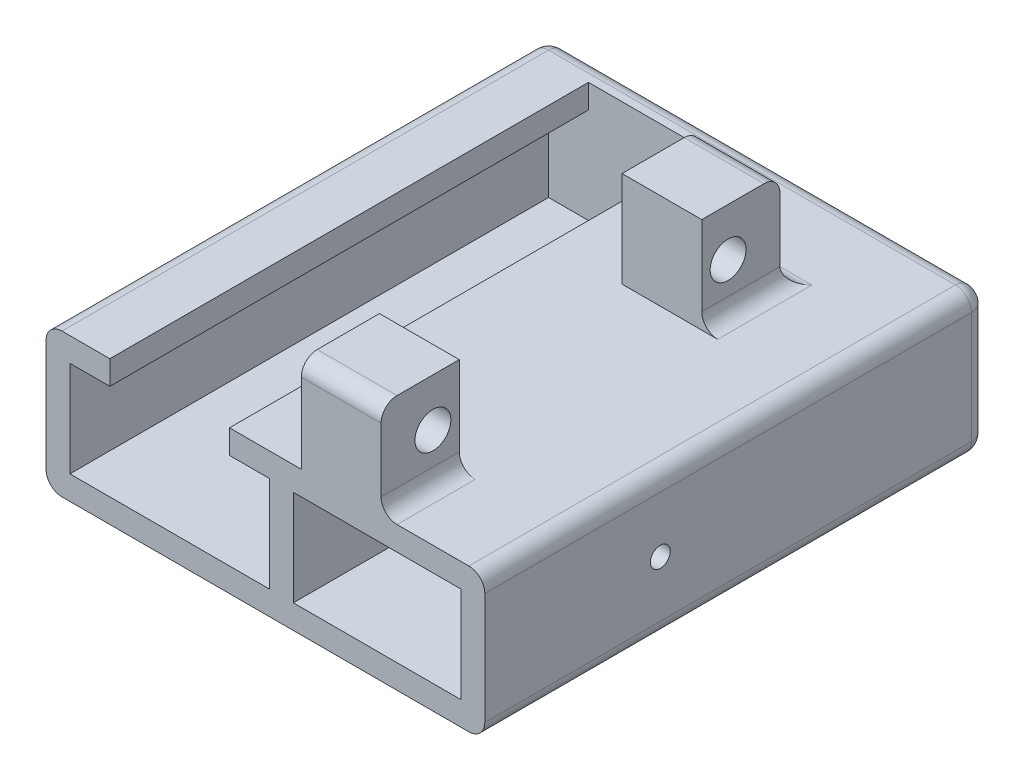
from build123d import *

# Parameters (mm, degrees)
SKETCH1_W           = 21
SKETCH1_H           = 12
BOSS_EXTRUDE1_DEPTH = 60
SKETCH2_R           = 2.25
BOSS_EXTRUDE2_DEPTH = 10
SKETCH3_W           = 55
SKETCH3_H           = 18
BOSS_EXTRUDE3_DEPTH = 3
FILLET1_R           = 2
SKETCH4_R           = 1.25
CUT_EXTRUDE1_DEPTH  = 30


with BuildPart() as part:
    # Sketch1 → Boss-Extrude1 (new body)
    with BuildSketch(Plane.XY):
        Polygon((17.509291985, 21.588576814), (-9.490708015, 21.588576814), (-14.490708015, 21.588576814), (-14.490708015, 18.588576814), (-9.490708015, 18.588576814), (-9.490708015, 6.588576814), (-34.490708015, 6.588576814), (-34.490708015, 18.588576814), (-29.490708015, 18.588576814), (-29.490708015, 21.588576814), (-34.490708015, 21.588576814), (-37.490708015, 21.588576814), (-37.490708015, 3.588576814), (17.509291985, 3.588576814), align=None)
        with Locations((4.009291985, 12.588576814)):
            Rectangle(SKETCH1_W, SKETCH1_H, mode=Mode.SUBTRACT)
    extrude(amount=-BOSS_EXTRUDE1_DEPTH)

    # Sketch2 → Boss-Extrude2 (add)
    # profile 1 of 2: a face of its own
    with BuildSketch(Plane(origin=(-5.490708015, 0, 0), x_dir=(0, 0, -1), z_dir=(1, 0, 0))):
        with BuildLine():
            Line((50, 21.588576814), (40.2, 21.588576814))
            Line((40.2, 21.588576814), (40.2, 33.588576814))
            Line((40.2, 33.588576814), (48, 33.588576814))
            ThreePointArc((48, 33.588576814), (49.414213562, 33.002790376), (50, 31.588576814))
            Line((50, 31.588576814), (50, 21.588576814))
        make_face()
        with Locations(Location((43.5, 27.588576814, 0), (0, 0, 90))):
            Circle(SKETCH2_R, mode=Mode.SUBTRACT)
    # profile 2 of 2: a face of its own
    with BuildSketch(Plane(origin=(-5.490708015, 0, 0), x_dir=(0, 0, -1), z_dir=(1, 0, 0))):
        with BuildLine():
            Line((9.8, 21.588576814), (0, 21.588576814))
            Line((0, 21.588576814), (0, 31.588576814))
            ThreePointArc((0, 31.588576814), (0.585786438, 33.002790376), (2, 33.588576814))
            Line((2, 33.588576814), (9.8, 33.588576814))
            Line((9.8, 33.588576814), (9.8, 21.588576814))
        make_face()
        with Locations(Location((6.5, 27.588576814, 0), (0, 0, 90))):
            Circle(SKETCH2_R, mode=Mode.SUBTRACT)
    extrude(amount=BOSS_EXTRUDE2_DEPTH)

    # Sketch3 → Boss-Extrude3 (add)
    with BuildSketch(Plane(origin=(0, 0, -60), x_dir=(-1, 0, 0), z_dir=(0, 0, -1))):
        with Locations((9.990708015, 12.588576814)):
            Rectangle(SKETCH3_W, SKETCH3_H)
    extrude(amount=BOSS_EXTRUDE3_DEPTH)

    # Fillet1
    fillet1_edges = [part.edges().sort_by_distance(p)[0] for p in [
        (17.509291985, 3.588576814, -31.5),
        (-37.490708015, 3.588576814, -31.5),
        (-37.490708015, 21.588576814, -31.5),
        (17.509291985, 21.588576814, -31.5),
        (4.509291985, 21.588576814, -45.1),
        (-0.490708015, 21.588576814, -50),
        (4.509291985, 21.588576814, -4.9),
        (17.509291985, 12.588576814, -63),
        (-9.990708015, 3.588576814, -63),
        (-37.490708015, 12.588576814, -63),
        (-9.990708015, 21.588576814, -63),
    ]]
    fillet(fillet1_edges, radius=FILLET1_R)

    # Sketch4 → Cut-Extrude1 (cut)
    with BuildSketch(Plane(origin=(17.509291985, 0, 0), x_dir=(0, 0, -1), z_dir=(1, 0, 0))):
        with Locations(Location((22, 12.588576814, 0), (0, 0, 270))):
            Circle(SKETCH4_R)
    extrude(amount=-CUT_EXTRUDE1_DEPTH, mode=Mode.SUBTRACT)


solid = part.part
